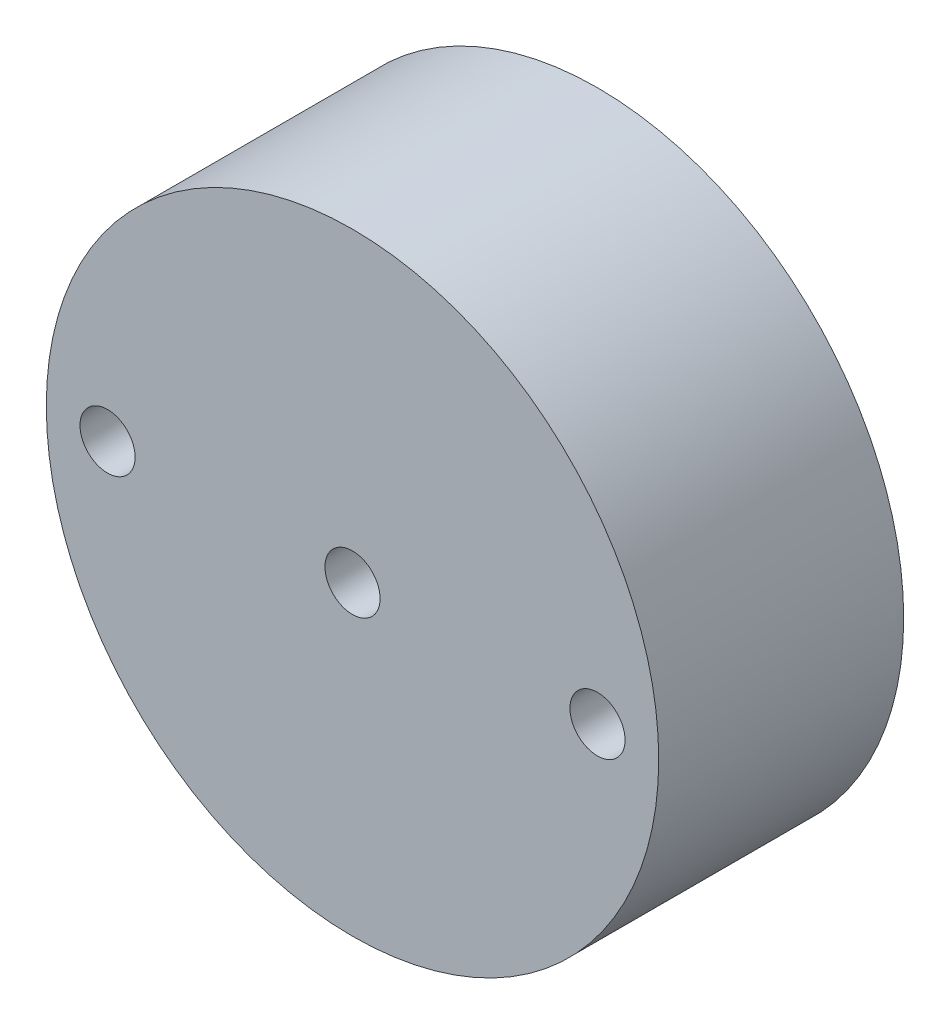
from build123d import *

# Parameters (mm, degrees)
SKETCH1_R           = 25
SKETCH1_R_2         = 2.25
BOSS_EXTRUDE1_DEPTH = 20


with BuildPart() as part:
    # Sketch1 → Boss-Extrude1 (new body)
    with BuildSketch(Plane.XY):
        with Locations((235, -6)):
            Circle(SKETCH1_R)
        with Locations((215, -6)):
            Circle(SKETCH1_R_2, mode=Mode.SUBTRACT)
        with Locations((255, -6)):
            Circle(SKETCH1_R_2, mode=Mode.SUBTRACT)
        with Locations((235, -6)):
            Circle(SKETCH1_R_2, mode=Mode.SUBTRACT)
    extrude(amount=BOSS_EXTRUDE1_DEPTH)


solid = part.part
